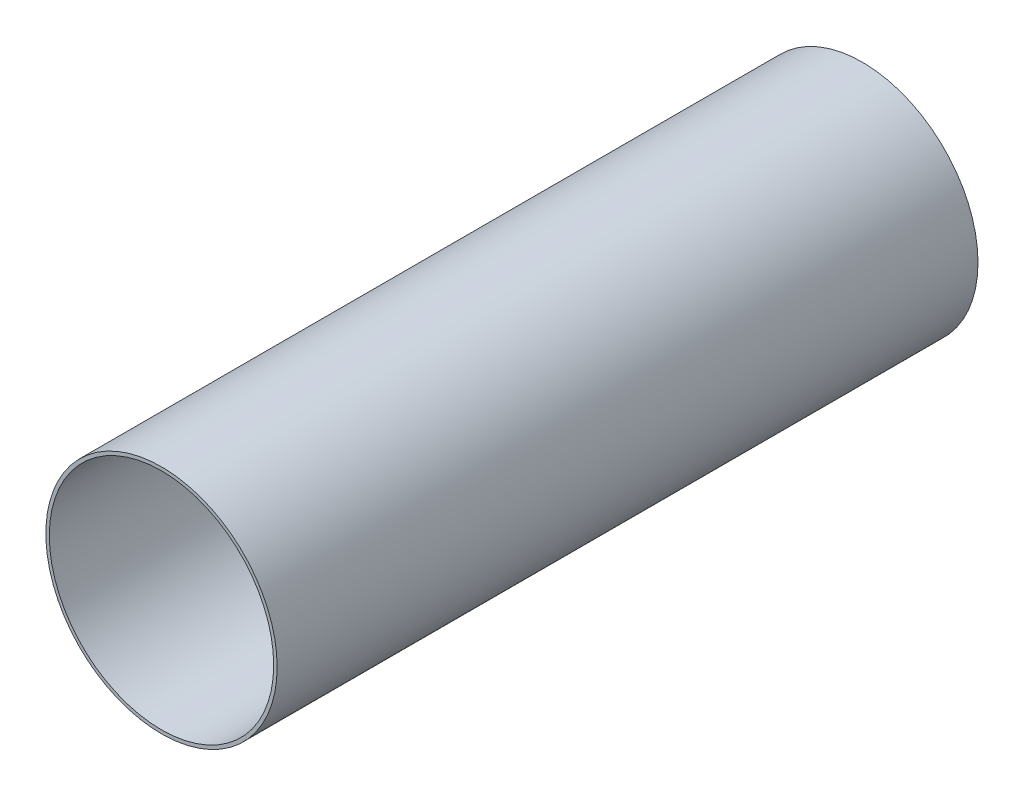
from build123d import *

# Parameters (mm, degrees)
SKETCH1_R           = 50
SKETCH1_R_2         = 48.5
BOSS_EXTRUDE1_DEPTH = 303
SKETCH1_2_R         = 48.5
BOSS_EXTRUDE2_DEPTH = 3


with BuildPart() as part:
    # Sketch1 → Boss-Extrude1 (new body)
    with BuildSketch(Plane.XY):
        Circle(SKETCH1_R)
        Circle(SKETCH1_R_2, mode=Mode.SUBTRACT)
    extrude(amount=BOSS_EXTRUDE1_DEPTH)

    # Sketch1<2> → Boss-Extrude2 (add)
    with BuildSketch(Plane.XY):
        Circle(SKETCH1_2_R)
    extrude(amount=BOSS_EXTRUDE2_DEPTH)


solid = part.part
